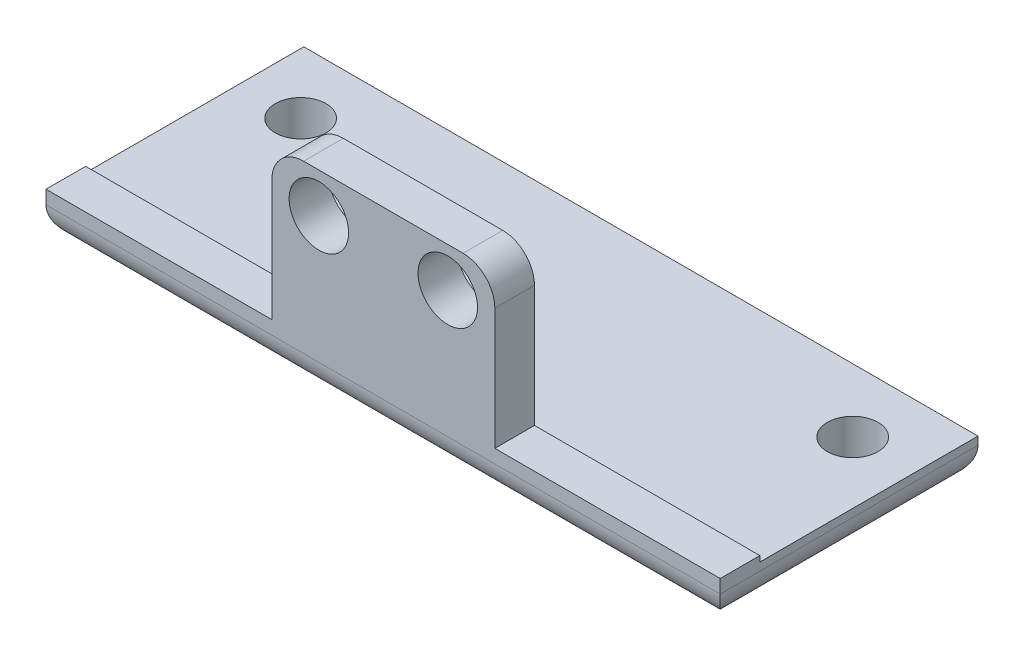
from build123d import *

# Parameters (mm, degrees)
ESQUISSE1_W             = 53.975
ESQUISSE1_H             = 12.7
BOSS_EXTRU_1_DEPTH      = 3.175
ESQUISSE2_R             = 2.032
ENL_V_MAT_EXTRU_1_DEPTH = 3.175
ESQUISSE3_W             = 53.975
ESQUISSE3_H             = 7.9375
BOSS_EXTRU_2_DEPTH      = 3.175
ESQUISSE4_W             = 53.975
ESQUISSE4_H             = 3.175
BOSS_EXTRU_3_DEPTH      = 12.7
ESQUISSE5_R             = 2.38125
ENL_V_MAT_EXTRU_2_DEPTH = 12.7
ESQUISSE6_W             = 18.084193737
ESQUISSE6_H             = 12.254267232
ESQUISSE6_W_2           = 18.044331553
ENL_V_MAT_EXTRU_3_DEPTH = 12.7
CONG_2_R                = 2.54


with BuildPart() as part:
    # Esquisse1 → Boss.-Extru.1 (new body)
    with BuildSketch(Plane(origin=(0, 0, 0), x_dir=(1, 0, 0), z_dir=(0, 1, 0))):
        with Locations((26.9875, 6.35)):
            Rectangle(ESQUISSE1_W, ESQUISSE1_H)
    extrude(amount=BOSS_EXTRU_1_DEPTH)

    # Esquisse2 → Enlèv. mat.-Extru.1 (cut)
    with BuildSketch(Plane(origin=(0, 3.175, 0), x_dir=(1, 0, 0), z_dir=(0, 1, 0))):
        with Locations(Location((4.826, 7.62, 0), (0, 0, 270))):
            Circle(ESQUISSE2_R)
        with Locations(Location((49.022, 7.62, 0), (0, 0, 270))):
            Circle(ESQUISSE2_R)
    extrude(amount=-ENL_V_MAT_EXTRU_1_DEPTH, mode=Mode.SUBTRACT)

    # Esquisse3 → Boss.-Extru.2 (add)
    with BuildSketch(Plane(origin=(0, 3.175, 0), x_dir=(1, 0, 0), z_dir=(0, 1, 0))):
        with Locations((26.9875, -3.96875)):
            Rectangle(ESQUISSE3_W, ESQUISSE3_H)
    extrude(amount=-BOSS_EXTRU_2_DEPTH)

    # Esquisse4 → Boss.-Extru.3 (add)
    with BuildSketch(Plane(origin=(0, 3.175, 0), x_dir=(1, 0, 0), z_dir=(0, 1, 0))):
        with Locations((26.9875, -6.35)):
            Rectangle(ESQUISSE4_W, ESQUISSE4_H)
    extrude(amount=BOSS_EXTRU_3_DEPTH)

    # Esquisse5 → Enlèv. mat.-Extru.2 (cut)
    with BuildSketch(Plane.XY.offset(7.9375)):
        with Locations((21.844, 12.7)):
            Circle(ESQUISSE5_R)
        with Locations((32.16275, 12.7)):
            Circle(ESQUISSE5_R)
    extrude(amount=-ENL_V_MAT_EXTRU_2_DEPTH, mode=Mode.SUBTRACT)

    # Esquisse6 → Enlèv. mat.-Extru.3 (cut)
    with BuildSketch(Plane.XY.offset(7.9375)):
        with Locations((9.042096868, 9.747866384)):
            Rectangle(ESQUISSE6_W, ESQUISSE6_H)
        with Locations((44.952834224, 9.747866384)):
            Rectangle(ESQUISSE6_W_2, ESQUISSE6_H)
    extrude(amount=-ENL_V_MAT_EXTRU_3_DEPTH, mode=Mode.SUBTRACT)

    # Congé2
    cong_2_edges = [part.edges().sort_by_distance(p)[0] for p in [
        (26.9875, 0, 7.9375),
        (26.9875, 0, -12.7),
        (53.975, 0, -2.38125),
        (0, 0, -2.38125),
        (35.930668447, 15.875, 6.35),
        (18.084193737, 15.875, 6.35),
    ]]
    fillet(cong_2_edges, radius=CONG_2_R)


solid = part.part
